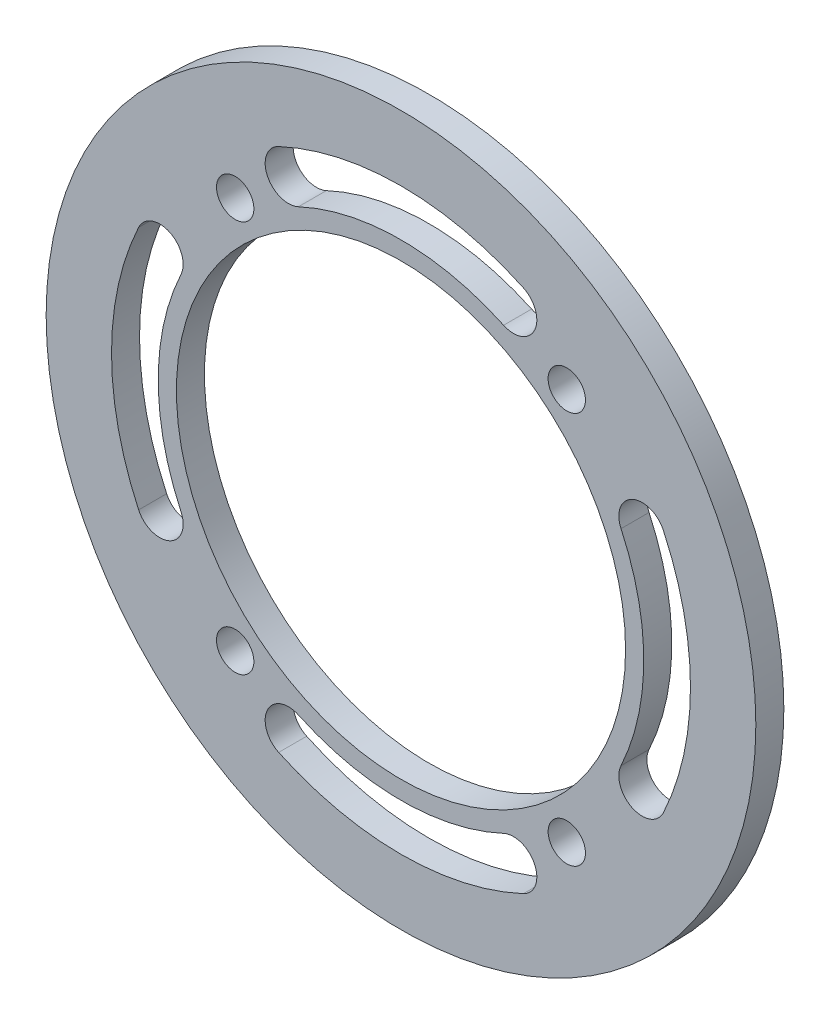
from build123d import *

# Parameters (mm, degrees)
SKETCH_1_R          = 38
SKETCH_1_R_2        = 24.05
EXTRUDE_1_DEPTH     = 3
SKETCH_3_R          = 2
CUT_EXTRUDE_1_DEPTH = 10
CUT_EXTRUDE_2_DEPTH = 10


with BuildPart() as part:
    # 草图1 → 凸台-拉伸1 (new body)
    with BuildSketch(Plane.XY):
        Circle(SKETCH_1_R)
        Circle(SKETCH_1_R_2, mode=Mode.SUBTRACT)
    extrude(amount=EXTRUDE_1_DEPTH)

    # 草图3 → 切除-拉伸1 (cut)
    with BuildSketch(Plane.XY.offset(3)):
        with Locations((17.755280905, -21)):
            Circle(SKETCH_3_R)
        with Locations((17.755280905, 21)):
            Circle(SKETCH_3_R)
        with Locations((-17.755280905, -21)):
            Circle(SKETCH_3_R)
        with Locations((-17.755280905, 21)):
            Circle(SKETCH_3_R)
    extrude(amount=-CUT_EXTRUDE_1_DEPTH, mode=Mode.SUBTRACT)

    # 草图4 → 切除-拉伸2 (cut)
    with BuildSketch(Plane.XY.offset(3)):
        with BuildLine():
            ThreePointArc((28.095541398, -13.101166114), (31, 0), (28.095541398, 13.101166114))
            ThreePointArc((28.095541398, 13.101166114), (24.773226276, 14.310389927), (23.564002463, 10.988074805))
            ThreePointArc((23.564002463, 10.988074805), (26, 0), (23.564002463, -10.988074805))
            ThreePointArc((23.564002463, -10.988074805), (24.773226276, -14.310389927), (28.095541398, -13.101166114))
        make_face()
        with BuildLine():
            ThreePointArc((-13.101166114, -28.095541398), (0, -31), (13.101166114, -28.095541398))
            ThreePointArc((13.101166114, -28.095541398), (14.310389927, -24.773226276), (10.988074805, -23.564002463))
            ThreePointArc((10.988074805, -23.564002463), (0, -26), (-10.988074805, -23.564002463))
            ThreePointArc((-10.988074805, -23.564002463), (-14.310389927, -24.773226276), (-13.101166114, -28.095541398))
        make_face()
        with BuildLine():
            ThreePointArc((-28.095541398, 13.101166114), (-31, 0), (-28.095541398, -13.101166114))
            ThreePointArc((-28.095541398, -13.101166114), (-24.773226276, -14.310389927), (-23.564002463, -10.988074805))
            ThreePointArc((-23.564002463, -10.988074805), (-26, 0), (-23.564002463, 10.988074805))
            ThreePointArc((-23.564002463, 10.988074805), (-24.773226276, 14.310389927), (-28.095541398, 13.101166114))
        make_face()
        with BuildLine():
            ThreePointArc((13.101166114, 28.095541398), (0, 31), (-13.101166114, 28.095541398))
            ThreePointArc((-13.101166114, 28.095541398), (-14.310389927, 24.773226276), (-10.988074805, 23.564002463))
            ThreePointArc((-10.988074805, 23.564002463), (0, 26), (10.988074805, 23.564002463))
            ThreePointArc((10.988074805, 23.564002463), (14.310389927, 24.773226276), (13.101166114, 28.095541398))
        make_face()
    extrude(amount=-CUT_EXTRUDE_2_DEPTH, mode=Mode.SUBTRACT)


solid = part.part
